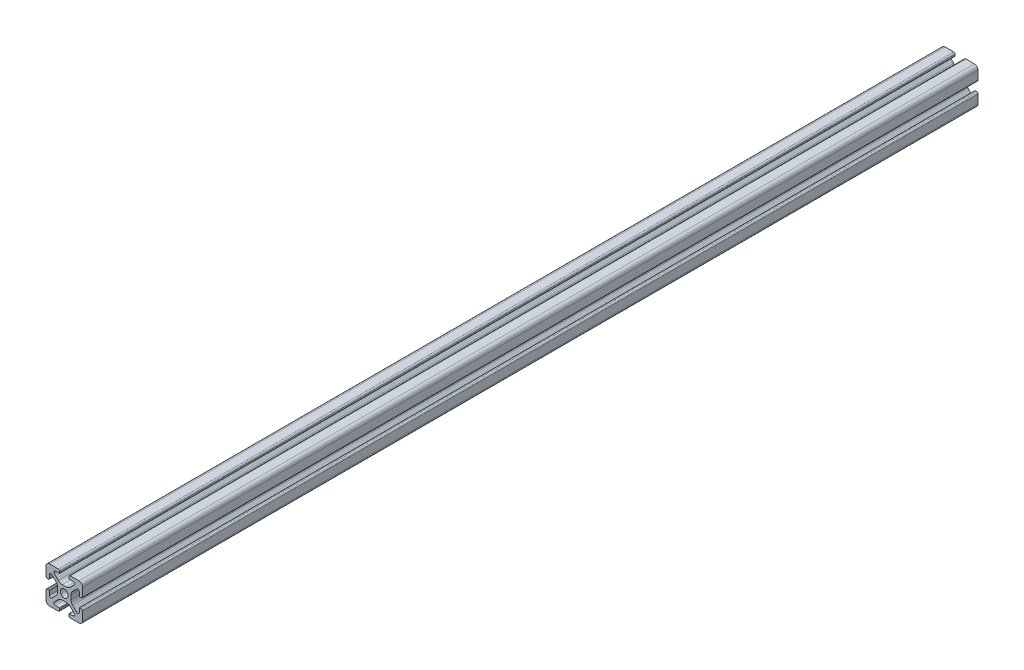
from build123d import *

# Parameters (mm, degrees)
ESQUISSE1_R        = 2.15
BOSS_EXTRU_1_DEPTH = 490


with BuildPart() as part:
    # Esquisse1 → Boss.-Extru.1 (new body)
    with BuildSketch(Plane(origin=(0, 0, 0), x_dir=(-1, 0, 0), z_dir=(0, 0, -1))):
        with BuildLine():
            Line((-12.499999997, 0.800000003), (-12.499999998, 1.500000003))
            ThreePointArc((-12.499999998, 1.500000003), (-12.587867964, 1.712132039), (-12.8, 1.800000005))
            Line((-12.8, 1.800000005), (-14.9175884, 1.800000005))
            ThreePointArc((-14.9175884, 1.800000005), (-15.686636444, 2.31386148), (-15.50619229, 3.2210155))
            Line((-15.50619229, 3.2210155), (-13.25588745, 5.47132034))
            ThreePointArc((-13.25588745, 5.47132034), (-12.282617404, 6.121638593), (-11.134567108, 6.349999996))
            Line((-11.134567108, 6.349999996), (-8.865432907, 6.349999996))
            ThreePointArc((-8.865432907, 6.349999996), (-7.717382611, 6.121638594), (-6.744112567, 5.471320341))
            Line((-6.744112567, 5.471320341), (-4.493807729, 3.221015503))
            ThreePointArc((-4.493807729, 3.221015503), (-4.313363575, 2.313861481), (-5.082411621, 1.800000005))
            Line((-5.082411621, 1.800000005), (-7.20000001, 1.800000005))
            ThreePointArc((-7.20000001, 1.800000005), (-7.412132045, 1.71213204), (-7.50000001, 1.500000005))
            Line((-7.50000001, 1.500000005), (-7.50000001, 0.8))
            ThreePointArc((-7.50000001, 0.8), (-7.265685435, 0.234314575), (-6.70000001, 0))
            Line((-6.70000001, 0), (-2, 0))
            ThreePointArc((-2, 0), (-0.585786438, 0.585786438), (0, 2))
            Line((0, 2), (0, 6.699999998))
            ThreePointArc((0, 6.699999998), (-0.234314576, 7.265685424), (-0.800000003, 7.5))
            Line((-0.800000003, 7.5), (-1.50000001, 7.5))
            ThreePointArc((-1.50000001, 7.5), (-1.712132046, 7.412132033), (-1.800000013, 7.199999997))
            Line((-1.800000013, 7.199999997), (-1.800000013, 5.082411603))
            ThreePointArc((-1.800000013, 5.082411603), (-2.313861487, 4.31336356), (-3.221015507, 4.493807713))
            Line((-3.221015507, 4.493807713), (-5.471320347, 6.744112553))
            ThreePointArc((-5.471320347, 6.744112553), (-6.1216386, 7.717382599), (-6.350000003, 8.865432896))
            Line((-6.350000003, 8.865432896), (-6.350000003, 11.134567102))
            ThreePointArc((-6.350000003, 11.134567102), (-6.121638601, 12.282617397), (-5.471320348, 13.255887442))
            Line((-5.471320348, 13.255887442), (-3.221015512, 15.506192278))
            ThreePointArc((-3.221015512, 15.506192278), (-2.313861489, 15.686636432), (-1.800000013, 14.917588386))
            Line((-1.800000013, 14.917588386), (-1.800000013, 12.799999998))
            ThreePointArc((-1.800000013, 12.799999998), (-1.712132047, 12.587867963), (-1.500000013, 12.499999997))
            Line((-1.500000013, 12.499999997), (-0.8, 12.499999997))
            ThreePointArc((-0.8, 12.499999997), (-0.234314575, 12.734314573), (0, 13.299999998))
            Line((0, 13.299999998), (0, 18))
            ThreePointArc((0, 18), (-0.585786438, 19.414213562), (-2, 20))
            Line((-2, 20), (-6.700000008, 20))
            ThreePointArc((-6.700000008, 20), (-7.265685435, 19.765685424), (-7.50000001, 19.199999998))
            Line((-7.50000001, 19.199999998), (-7.50000001, 18.500000005))
            ThreePointArc((-7.50000001, 18.500000005), (-7.412132044, 18.287867969), (-7.200000008, 18.200000003))
            Line((-7.200000008, 18.200000003), (-5.082411594, 18.200000003))
            ThreePointArc((-5.082411594, 18.200000003), (-4.313363546, 17.686138526), (-4.493807701, 16.778984501))
            Line((-4.493807701, 16.778984501), (-6.744112542, 14.528679659))
            ThreePointArc((-6.744112542, 14.528679659), (-7.717382588, 13.878361406), (-8.865432885, 13.650000003))
            Line((-8.865432885, 13.650000003), (-11.134567112, 13.650000003))
            ThreePointArc((-11.134567112, 13.650000003), (-12.282617407, 13.878361405), (-13.255887452, 14.528679658))
            Line((-13.255887452, 14.528679658), (-15.506192292, 16.778984498))
            ThreePointArc((-15.506192292, 16.778984498), (-15.686636447, 17.686138525), (-14.917588397, 18.200000002))
            Line((-14.917588397, 18.200000002), (-12.799999998, 18.200000003))
            ThreePointArc((-12.799999998, 18.200000003), (-12.587867963, 18.287867968), (-12.499999997, 18.500000002))
            Line((-12.499999997, 18.500000002), (-12.499999997, 19.2))
            ThreePointArc((-12.499999997, 19.2), (-12.734314573, 19.765685425), (-13.299999998, 20))
            Line((-13.299999998, 20), (-18, 20))
            ThreePointArc((-18, 20), (-19.414213562, 19.414213562), (-20, 18))
            Line((-20, 18), (-20, 13.3))
            ThreePointArc((-20, 13.3), (-19.765685424, 12.734314573), (-19.199999998, 12.499999997))
            Line((-19.199999998, 12.499999997), (-18.500000003, 12.499999997))
            ThreePointArc((-18.500000003, 12.499999997), (-18.287867967, 12.587867964), (-18.2, 12.8))
            Line((-18.2, 12.8), (-18.2, 14.91758839))
            ThreePointArc((-18.2, 14.91758839), (-17.686138526, 15.686636434), (-16.778984506, 15.50619228))
            Line((-16.778984506, 15.50619228), (-14.528679657, 13.255887431))
            ThreePointArc((-14.528679657, 13.255887431), (-13.878361403, 12.282617385), (-13.650000001, 11.134567088))
            Line((-13.650000001, 11.134567088), (-13.650000001, 8.865432886))
            ThreePointArc((-13.650000001, 8.865432886), (-13.878361403, 7.717382591), (-14.528679656, 6.744112546))
            Line((-14.528679656, 6.744112546), (-16.778984496, 4.493807706))
            ThreePointArc((-16.778984496, 4.493807706), (-17.686138522, 4.313363551), (-18.2, 5.0824116))
            Line((-18.2, 5.0824116), (-18.2, 7.2))
            ThreePointArc((-18.2, 7.2), (-18.287867966, 7.412132034), (-18.5, 7.5))
            Line((-18.5, 7.5), (-19.2, 7.5))
            ThreePointArc((-19.2, 7.5), (-19.765685425, 7.265685425), (-20, 6.7))
            Line((-20, 6.7), (-20, 2))
            ThreePointArc((-20, 2), (-19.414213562, 0.585786438), (-18, 0))
            Line((-18, 0), (-13.3, 0))
            ThreePointArc((-13.3, 0), (-12.734314573, 0.234314576), (-12.499999997, 0.800000003))
        make_face()
        with Locations(Location((-10, 10, 0), (0, 0, 180))):
            Circle(ESQUISSE1_R, mode=Mode.SUBTRACT)
    extrude(amount=-BOSS_EXTRU_1_DEPTH)


solid = part.part
